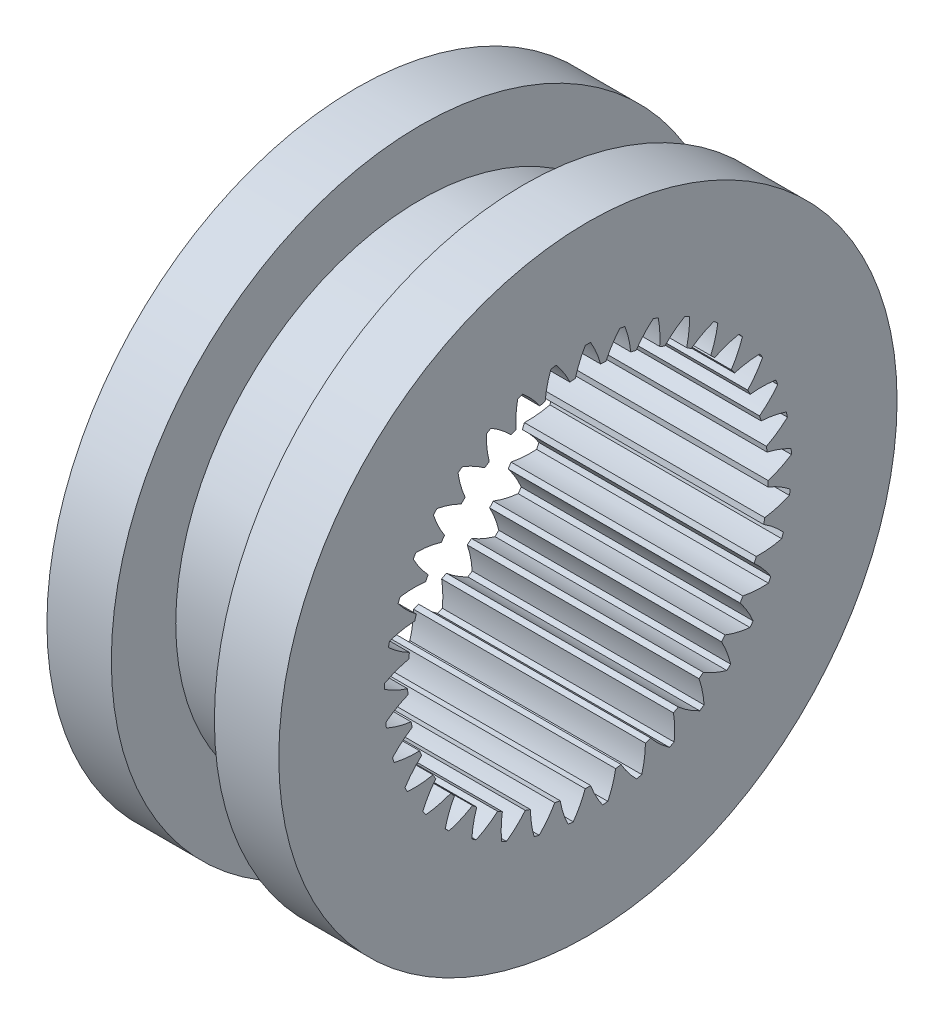
from build123d import *

# Parameters (mm, degrees)
TOOTHCUT_DEPTH  = 39.418745425
TEETHCUTS_COUNT = 37
TEETHCUTS_ANGLE = 350.27027027


with BuildPart() as part:
    # BasProSke → Base-Revolve (revolve)
    with BuildSketch(Plane(origin=(0, 0, 0), x_dir=(1, 0, 0), z_dir=(0, 1, 0)), mode=Mode.PRIVATE) as base_revolve_sk:
        Polygon((0, 14), (0, 24), (5, 24), (5, 19), (13, 19), (13, 24), (18, 24), (18, 14), align=None)
    revolve(base_revolve_sk.sketch.rotate(Axis((-10, 0, 0), (1, 0, 0)), 180), axis=Axis((-10, 0, 0), (1, 0, 0)))

    # TooCutSke → ToothCut (cut, through all)
    with BuildSketch(Plane(origin=(0, 0, 0), x_dir=(0, 0, -1), z_dir=(1, 0, 0))):
        with BuildLine():
            ThreePointArc((0.982732024, 13.940002974), (0.656790448, 14.896507566), (0.203576274, 15.799688532))
            ThreePointArc((0.203576274, 15.799688532), (0, 15.801), (-0.203576274, 15.799688532))
            ThreePointArc((-0.203576274, 15.799688532), (-0.656790448, 14.896507566), (-0.982732024, 13.940002974))
            ThreePointArc((-0.982732024, 13.940002974), (0, 13.9746), (0.982732024, 13.940002974))
        make_face()
    toothcut = extrude(amount=TOOTHCUT_DEPTH, mode=Mode.SUBTRACT)

    # TeethCuts: ToothCut ×37 about axis
    teethcuts_axis = Axis((-10, 0, 0), (1, 0, 0))
    for i in range(1, TEETHCUTS_COUNT):
        add(toothcut.rotate(teethcuts_axis, i * TEETHCUTS_ANGLE / (TEETHCUTS_COUNT - 1)), mode=Mode.SUBTRACT)


solid = part.part
